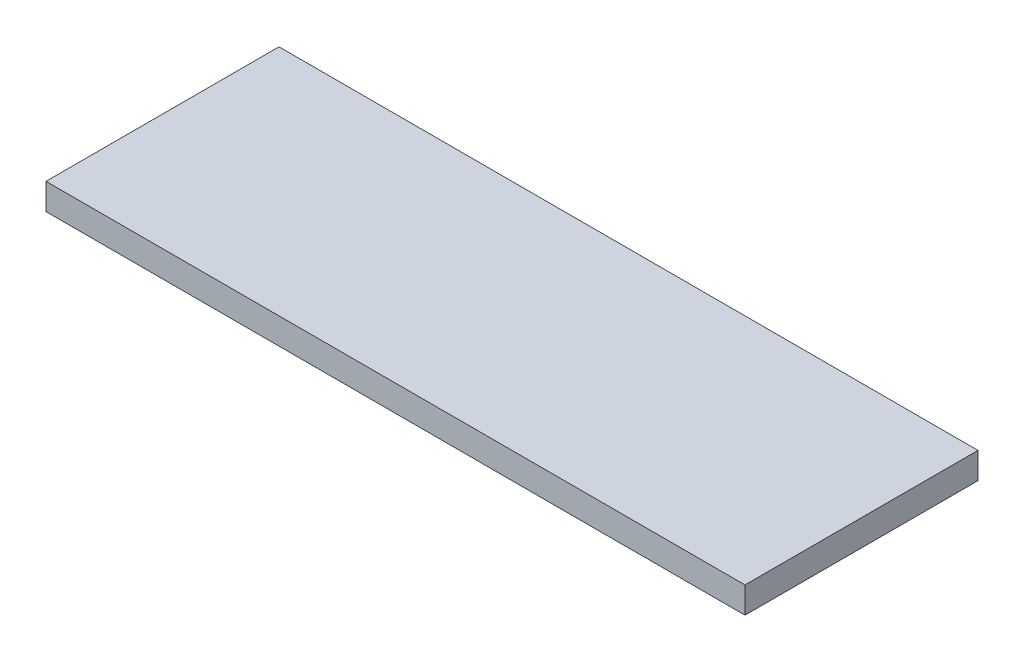
from build123d import *

# Parameters (mm, degrees)
SKETCH_1_W      = 120
SKETCH_1_H      = 40
EXTRUDE_1_DEPTH = 4.5


with BuildPart() as part:
    # 草图1 → 凸台-拉伸1 (new body)
    with BuildSketch(Plane(origin=(0, 0, 0), x_dir=(1, 0, 0), z_dir=(0, 1, 0))):
        with Locations((60, 20)):
            Rectangle(SKETCH_1_W, SKETCH_1_H)
    extrude(amount=EXTRUDE_1_DEPTH)


solid = part.part
